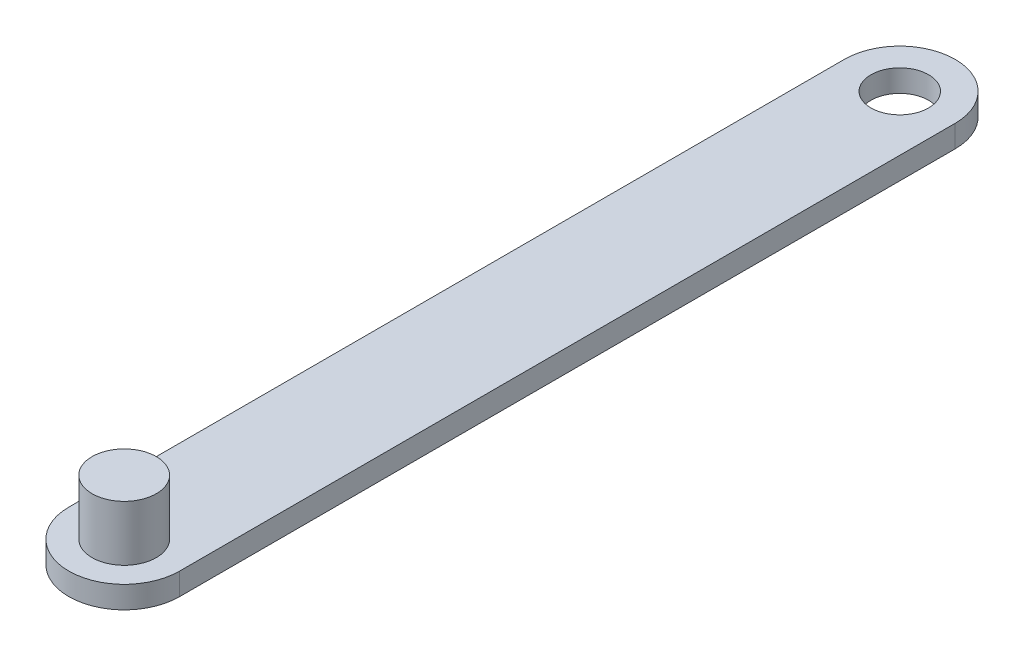
from build123d import *

# Parameters (mm, degrees)
BOSS_EXTRUDE1_DEPTH = 2
SKETCH2_R           = 2.6
CUT_EXTRUDE1_DEPTH  = 2
SKETCH3_R           = 2.9
BOSS_EXTRUDE2_DEPTH = 5


with BuildPart() as part:
    # Sketch1 → Boss-Extrude1 (new body)
    with BuildSketch(Plane(origin=(0, 0, 0), x_dir=(1, 0, 0), z_dir=(0, 1, 0))):
        with BuildLine():
            Line((0, 0), (0, 70))
            ThreePointArc((0, 70), (4.997476109, 75.002523891), (10, 70.005047783))
            Line((10, 70.005047783), (10, 0))
            ThreePointArc((10, 0), (5, -5), (0, 0))
        make_face()
    extrude(amount=BOSS_EXTRUDE1_DEPTH)

    # Sketch2 → Cut-Extrude1 (cut)
    with BuildSketch(Plane(origin=(0, 2, 0), x_dir=(1, 0, 0), z_dir=(0, 1, 0))):
        with Locations(Location((5, 70, 0), (0, 0, 270))):
            Circle(SKETCH2_R)
    extrude(amount=-CUT_EXTRUDE1_DEPTH, mode=Mode.SUBTRACT)

    # Sketch3 → Boss-Extrude2 (add)
    with BuildSketch(Plane(origin=(0, 2, 0), x_dir=(1, 0, 0), z_dir=(0, 1, 0))):
        with Locations(Location((5, 0, 0), (0, 0, 270))):
            Circle(SKETCH3_R)
    extrude(amount=BOSS_EXTRUDE2_DEPTH)


solid = part.part
